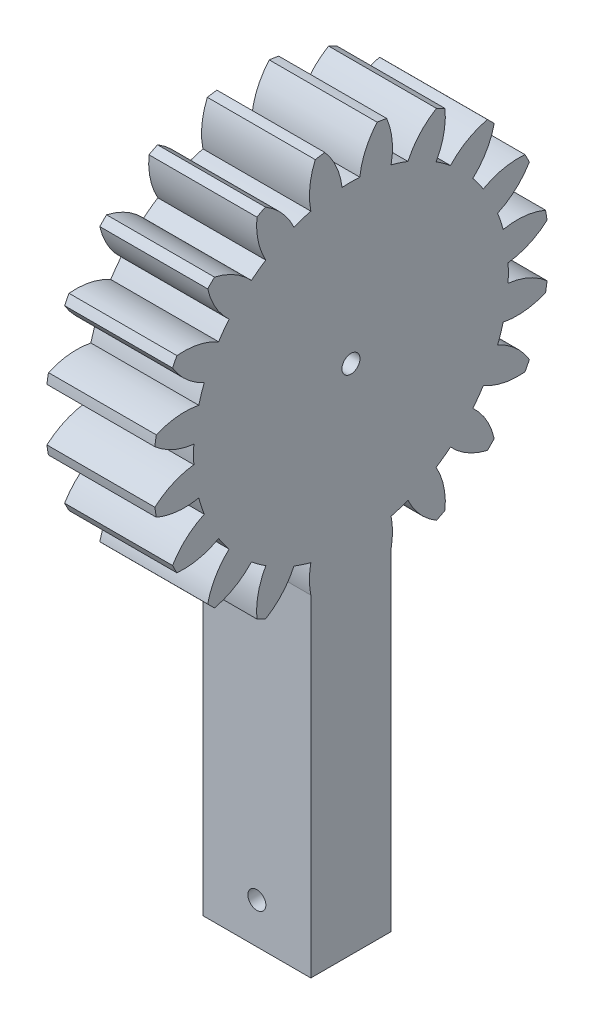
from build123d import *

# Parameters (mm, degrees)
BASPROSKE_W         = 30
BASPROSKE_H         = 55
TOOTHCUT_DEPTH      = 84.366660003
TEETHCUTS_COUNT     = 20
BORSKE_R            = 2.5
BORE_DEPTH          = 50.0000508
EXTRUDE_START       = -30
EXTRUDE_1_DEPTH     = 30
SKETCH_7_R          = 2.5
CUT_EXTRUDE_1_DEPTH = 160.570441323


with BuildPart() as part:
    # BasProSke → Base-Revolve (revolve)
    with BuildSketch(Plane(origin=(0, 0, 0), x_dir=(1, 0, 0), z_dir=(0, 1, 0)), mode=Mode.PRIVATE) as base_revolve_sk:
        with Locations((15, 27.5)):
            Rectangle(BASPROSKE_W, BASPROSKE_H)
    revolve(base_revolve_sk.sketch.rotate(Axis((-10, 0, 0), (1, 0, 0)), 180), axis=Axis((-10, 0, 0), (1, 0, 0)))

    # TooCutSke → ToothCut (cut, through all)
    with BuildSketch(Plane(origin=(0, 0, 0), x_dir=(0, 0, -1), z_dir=(1, 0, 0))):
        with BuildLine():
            ThreePointArc((2.464838288, 43.679509764), (0, 43.749), (-2.464838288, 43.679509764))
            ThreePointArc((-2.464838288, 43.679509764), (-4.057398861, 49.476814676), (-7.300899231, 54.538899105))
            ThreePointArc((-7.300899231, 54.538899105), (0, 55.0254), (7.300899231, 54.538899105))
            ThreePointArc((7.300899231, 54.538899105), (4.057398861, 49.476814676), (2.464838288, 43.679509764))
        make_face()
    toothcut = extrude(amount=TOOTHCUT_DEPTH, mode=Mode.SUBTRACT)

    # TeethCuts: ToothCut ×20 about axis
    teethcuts_axis = Axis((0, 0, 0), (1, 0, 0))
    for i in range(1, TEETHCUTS_COUNT):
        add(toothcut.rotate(teethcuts_axis, i * 360 / TEETHCUTS_COUNT), mode=Mode.SUBTRACT)

    # BorSke → Bore (cut, symmetric)
    with BuildSketch(Plane(origin=(0, 0, 0), x_dir=(0, 0, -1), z_dir=(1, 0, 0))):
        with Locations(Location((0, 0, 0), (0, 0, 180))):
            Circle(BORSKE_R)
    extrude(amount=BORE_DEPTH, both=True, mode=Mode.SUBTRACT)

    # 草图6 → 凸台-拉伸1 (add)
    with BuildSketch(Plane(origin=(30, 0, 0), x_dir=(0, 0, -1), z_dir=(1, 0, 0)).offset(EXTRUDE_START)):
        with BuildLine():
            Line((-11.153510308, -42.303359309), (-11.153510308, -142.303359309))
            Line((-11.153510308, -142.303359309), (11.153510308, -142.303359309))
            Line((11.153510308, -142.303359309), (11.153510308, -42.303359309))
            ThreePointArc((11.153510308, -42.303359309), (0, -43.749), (-11.153510308, -42.303359309))
        make_face()
    extrude(amount=EXTRUDE_1_DEPTH)

    # 草图7 → 切除-拉伸1 (cut, through all)
    with BuildSketch(Plane.XY.offset(11.153510308)):
        with Locations((15, -131.019533407)):
            Circle(SKETCH_7_R)
    extrude(amount=-CUT_EXTRUDE_1_DEPTH, mode=Mode.SUBTRACT)


solid = part.part
